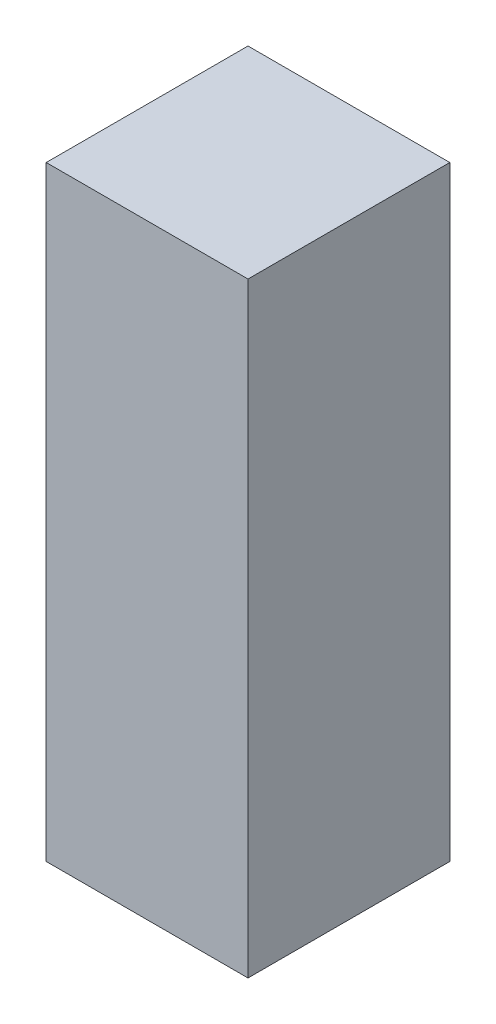
from build123d import *

# Parameters (mm, degrees)
SKETCH1_W           = 3.175
SKETCH1_H           = 3.175
BOSS_EXTRUDE1_DEPTH = 9.525


with BuildPart() as part:
    # Sketch1 → Boss-Extrude1 (new body)
    with BuildSketch(Plane(origin=(0, 0, 0), x_dir=(1, 0, 0), z_dir=(0, 1, 0))):
        with Locations((0.673484848, -0.457007576)):
            Rectangle(SKETCH1_W, SKETCH1_H)
    extrude(amount=BOSS_EXTRUDE1_DEPTH)


solid = part.part
